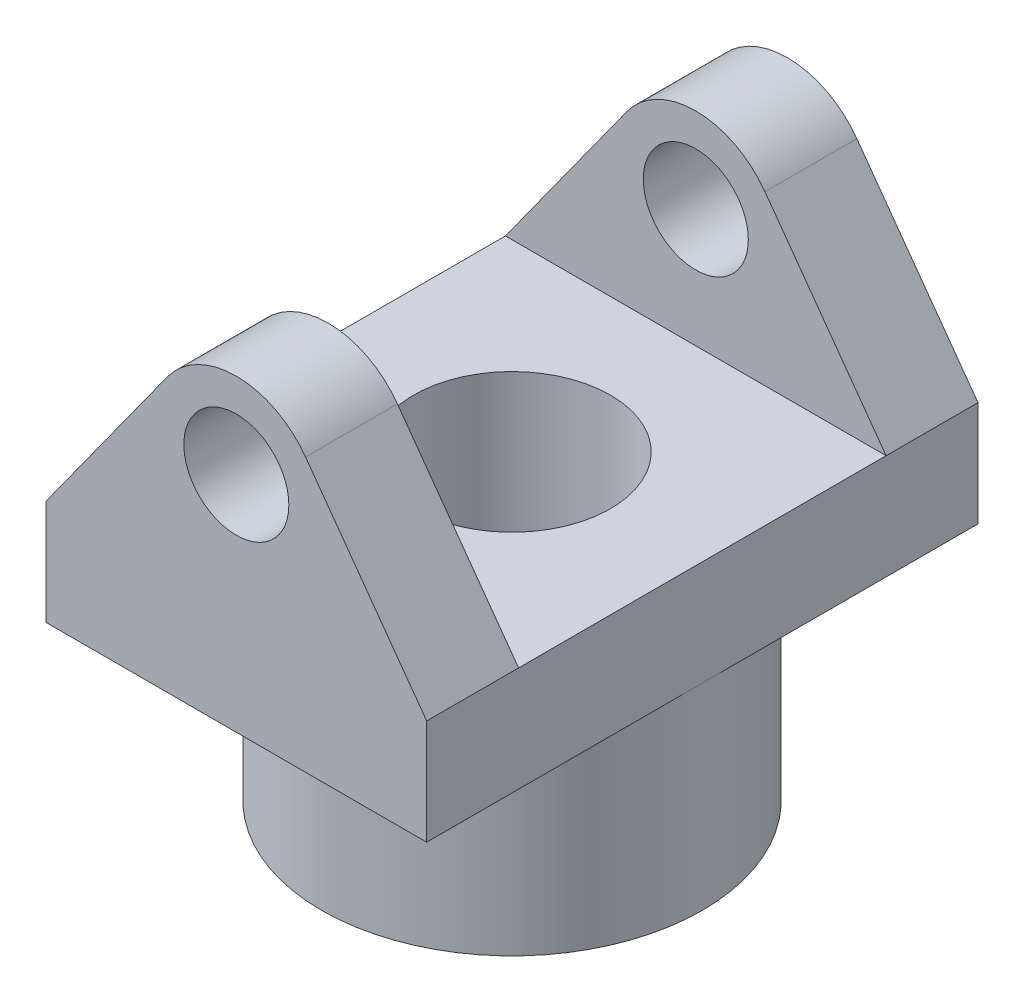
from build123d import *

# Parameters (mm, degrees)
SKETCH1_R           = 29
BOSS_EXTRUDE1_DEPTH = 30
SKETCH3_W           = 58
SKETCH3_H           = 84
BOSS_EXTRUDE2_DEPTH = 16
SKETCH4_R           = 8
EXTRUDE_Q_DEPTH     = 14
CUT_EXTRUDE1_DEPTH  = 93.379651439


with BuildPart() as part:
    # Sketch1 → Boss-Extrude1 (new body)
    with BuildSketch(Plane(origin=(0, 0, 0), x_dir=(-1, 0, 0), z_dir=(0, 1, 0))):
        with Locations(Location((0, 0, 0), (0, 0, 90))):
            Circle(SKETCH1_R)
    extrude(amount=BOSS_EXTRUDE1_DEPTH)

    # Sketch3 → Boss-Extrude2 (add)
    with BuildSketch(Plane(origin=(0, 30, 0), x_dir=(-1, 0, 0), z_dir=(0, 1, 0))):
        Rectangle(SKETCH3_W, SKETCH3_H)
    extrude(amount=BOSS_EXTRUDE2_DEPTH)

    # Sketch4 → Extrude q (add)
    with BuildSketch(Plane.XY.offset(42)):
        with BuildLine():
            Line((-29, 30), (-29, 46))
            Line((-29, 46), (-10.54585016, 71.60164748))
            ThreePointArc((-10.54585016, 71.60164748), (0, 77), (10.54585016, 71.60164748))
            Line((10.54585016, 71.60164748), (29, 46))
            Line((29, 46), (29, 30))
            Line((29, 30), (-29, 30))
        make_face()
        with Locations((0, 64)):
            Circle(SKETCH4_R, mode=Mode.SUBTRACT)
    extrude_q = extrude(amount=-EXTRUDE_Q_DEPTH)

    # Mirror1: Extrude q across plane
    add(extrude_q.mirror(Plane.XY))

    # Sketch5 → Cut-Extrude1 (cut, through all)
    with BuildSketch(Plane.XZ):
        with BuildLine():
            Line((-4, 17.456832295), (4, 17.456832295))
            Line((4, 17.456832295), (4, 14.456832295))
            ThreePointArc((4, 14.456832295), (0, -15), (-4, 14.456832295))
            Line((-4, 14.456832295), (-4, 17.456832295))
        make_face()
    extrude(amount=-CUT_EXTRUDE1_DEPTH, mode=Mode.SUBTRACT)


solid = part.part
